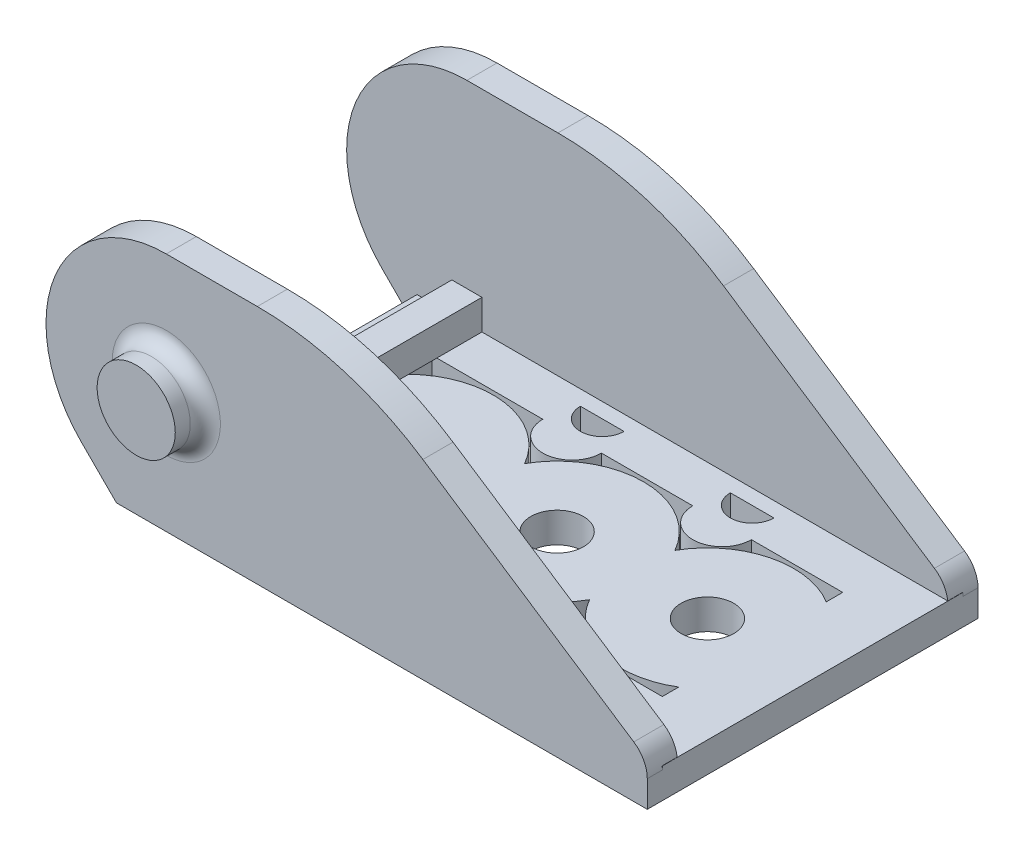
from build123d import *

# Parameters (mm, degrees)
SKETCH6_W               = 40
SKETCH6_H               = 2
BOSS_EXTRUDE4_DEPTH     = 16
SKETCH8_R               = 2.6
BOSS_EXTRUDE5_DEPTH     = 2
FILLET1_R               = 1
CUT_EXTRUDE1_DEPTH      = 26.690465157
CUT_EXTRUDE1_DEPTH_BACK = 16
SKETCH7_W               = 42.708590122
SKETCH7_H               = 18.182038554
SKETCH14_R              = 1.749999912
SKETCH14_R_2            = 1.749999996
SKETCH14_R_3            = 1.749999993
BOSS_EXTRUDE8_DEPTH     = 2
SKETCH15_W              = 2
SKETCH15_H              = 18
EXTRUDE_THIN1_DEPTH     = 2


with BuildPart() as part:
    # Sketch6 → Boss-Extrude4 (new body)
    with BuildSketch(Plane(origin=(0, 0, 0), x_dir=(1, 0, 0), z_dir=(0, 1, 0))):
        with Locations((0, -10)):
            Rectangle(SKETCH6_W, SKETCH6_H)
    extrude(amount=BOSS_EXTRUDE4_DEPTH)

    # Sketch8 → Boss-Extrude5 (add)
    with BuildSketch(Plane.XY.offset(11)):
        with Locations(Location((-12, 8, 0), (0, 0, 180))):
            Circle(SKETCH8_R)
    extrude(amount=BOSS_EXTRUDE5_DEPTH)

    # Fillet1
    fillet1_edges = [part.edges().sort_by_distance(p)[0] for p in [
        (-9.4, 8, 11),
    ]]
    fillet(fillet1_edges, radius=FILLET1_R)

    # Sketch7 → Cut-Extrude1 (cut, two sides: drawn at the far end of the back side and taken through both)
    with BuildSketch(Plane.XY.offset(11).offset(-CUT_EXTRUDE1_DEPTH_BACK)):
        with Locations((0, 8)):
            Rectangle(SKETCH7_W, SKETCH7_H)
        with BuildLine():
            Line((-5.942038411, 16), (-12, 16))
            ThreePointArc((-12, 16), (-19.39103626, 11.061467459), (-17.656854249, 2.343145751))
            Line((-17.656854249, 2.343145751), (-15.313708499, 0))
            Line((-15.313708499, 0), (20, 0))
            Line((20, 0), (20, 1.767244224))
            ThreePointArc((20, 1.767244224), (19.761112544, 2.715127447), (19.101517394, 3.43657326))
            Line((19.101517394, 3.43657326), (5.07313553, 12.69329036))
            ThreePointArc((5.07313553, 12.69329036), (-0.191638738, 15.155492779), (-5.942038411, 16))
        make_face(mode=Mode.SUBTRACT)
    extrude(amount=CUT_EXTRUDE1_DEPTH + CUT_EXTRUDE1_DEPTH_BACK, mode=Mode.SUBTRACT)


with BuildPart() as body_2:
    # Mirror2: mirrored copy
    add(part.part.mirror(Plane.XY))


with BuildPart() as part_1:
    add(part.part)

    add(body_2.part)  # Boss-Extrude8 merges body 2
    # Sketch14 → Boss-Extrude8 (add)
    with BuildSketch(Plane(origin=(0, 0, 0), x_dir=(1, 0, 0), z_dir=(0, 1, 0))):
        Polygon((-15.313708496, -10), (-15.313708496, 10), (20.000000038, 10), (19.999999862, -10), align=None)
        with Locations(Location((12.999999996, -3e-07, 0), (0, 0, 270))):
            Circle(SKETCH14_R, mode=Mode.SUBTRACT)
        with Locations(Location((3, -1.24e-07, 0), (0, 0, 270))):
            Circle(SKETCH14_R_2, mode=Mode.SUBTRACT)
        with Locations(Location((-6.999999997, -1.24e-07, 0), (0, 0, 270))):
            Circle(SKETCH14_R_3, mode=Mode.SUBTRACT)
        with BuildLine():
            Line((16.000000003, 6), (9.925463662, 6))
            ThreePointArc((9.925463662, 6), (7.975463662, 4.05), (6.025463662, 6))
            Line((6.025463662, 6), (-0.049072678, 6))
            ThreePointArc((-0.049072678, 6), (-1.999999996, 4.049072682), (-3.950927314, 6))
            Line((-3.950927314, 6), (-11.313708496, 6))
            Line((-11.313708496, 6), (-11.313708496, 3.801896638))
            ThreePointArc((-11.313708496, 3.801896638), (-6.408964515, 5.719543307), (-1.999999996, 2.839454047))
            ThreePointArc((-1.999999996, 2.839454047), (3.000000101, 5.749999872), (8.000000096, 2.83945387))
            ThreePointArc((8.000000096, 2.83945387), (11.562298515, 5.567361143), (15.999999994, 4.905353815))
            Line((15.999999994, 4.905353815), (16.000000003, 6))
        make_face(mode=Mode.SUBTRACT)
        with BuildLine():
            Line((-11.313708496, -6), (-11.313708496, -3.801896885))
            ThreePointArc((-11.313708496, -3.801896885), (-6.408964515, -5.719543555), (-1.999999996, -2.839454295))
            ThreePointArc((-1.999999996, -2.839454295), (3, -5.75000012), (7.999999996, -2.839454295))
            ThreePointArc((7.999999996, -2.839454295), (11.562298368, -5.567361705), (15.999999907, -4.905354469))
            Line((15.999999907, -4.905354469), (15.999999897, -6))
            Line((15.999999897, -6), (9.949999996, -6))
            ThreePointArc((9.949999996, -6), (7.999999996, -4.05), (6.049999996, -6))
            Line((6.049999996, -6), (-0.049999996, -6))
            ThreePointArc((-0.049999996, -6), (-1.999999996, -4.05), (-3.949999996, -6))
            Line((-3.949999996, -6), (-11.313708496, -6))
        make_face(mode=Mode.SUBTRACT)
        with BuildLine():
            Line((9.425463662, 8), (6.525463662, 8))
            ThreePointArc((6.525463662, 8), (7.975463662, 6.55), (9.425463662, 8))
        make_face(mode=Mode.SUBTRACT)
        with BuildLine():
            Line((-3.449999996, -8), (-0.549999996, -8))
            ThreePointArc((-0.549999996, -8), (-1.999999996, -6.55), (-3.449999996, -8))
        make_face(mode=Mode.SUBTRACT)
        with BuildLine():
            Line((-0.549999996, 8), (-3.449999996, 8))
            ThreePointArc((-3.449999996, 8), (-1.999999996, 6.55), (-0.549999996, 8))
        make_face(mode=Mode.SUBTRACT)
        with BuildLine():
            Line((6.549999996, -8), (9.449999996, -8))
            ThreePointArc((9.449999996, -8), (7.999999996, -6.55), (6.549999996, -8))
        make_face(mode=Mode.SUBTRACT)
    extrude(amount=BOSS_EXTRUDE8_DEPTH)

    # Sketch15 → Extrude-Thin1 (add)
    with BuildSketch(Plane(origin=(0, 2, 0), x_dir=(1, 0, 0), z_dir=(0, 1, 0))):
        with Locations((-12, 0)):
            Rectangle(SKETCH15_W, SKETCH15_H)
    extrude(amount=EXTRUDE_THIN1_DEPTH)


solid = part_1.part
